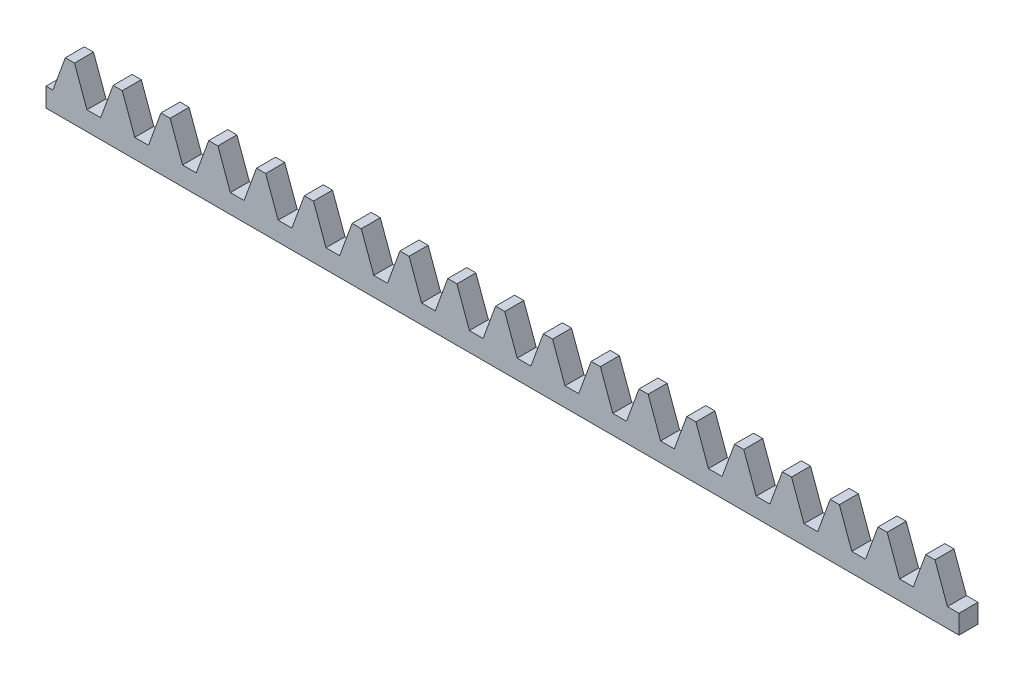
from build123d import *

# Parameters (mm, degrees)
BLANKSKE_W        = 152.4
BLANKSKE_H        = 8.89
BLANK_DEPTH       = 3.175
TOOTHCUTSIM_DEPTH = 153.692084684
TEETHCUTS_COUNT   = 20
TEETHCUTS_PITCH   = 7.979645331


with BuildPart() as part:
    # BlankSke → Blank (new body)
    with BuildSketch(Plane.XY):
        with Locations((76.2, 4.445)):
            Rectangle(BLANKSKE_W, BLANKSKE_H)
    extrude(amount=-BLANK_DEPTH)

    # TooCutSkeSim → ToothCutSim (cut, through all)
    with BuildSketch(Plane.XY):
        Polygon((1.144105839, 3.175), (-1.144105839, 3.175), (-3.233440572, 8.9154), (3.233440572, 8.9154), align=None)
    toothcutsim = extrude(amount=-TOOTHCUTSIM_DEPTH, mode=Mode.SUBTRACT)

    # TeethCuts: ToothCutSim ×20
    with Locations(*[(i * TEETHCUTS_PITCH, 0, 0) for i in range(1, TEETHCUTS_COUNT)]):
        add(toothcutsim, mode=Mode.SUBTRACT)


solid = part.part
